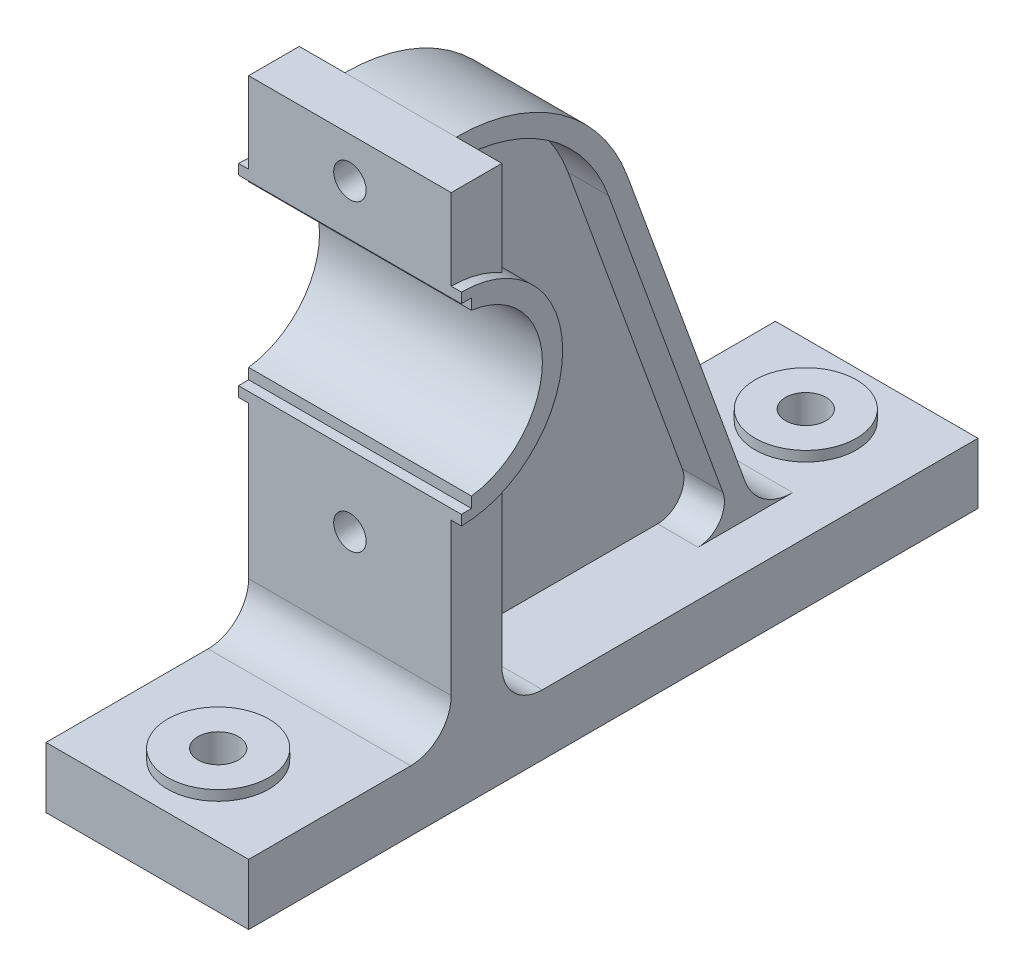
from build123d import *

# Parameters (mm, degrees)
BOSS_EXTRUDE1_DEPTH     = 50
BOSS_EXTRUDE4_DEPTH     = 55
BOSS_EXTRUDE5_DEPTH     = 27.5
CUT_EXTRUDE1_DEPTH      = 20
FILLET1_R               = 13
FILLET2_R               = 25
FILLET3_R               = 10
FILLET4_R               = 20
CUT_EXTRUDE2_DEPTH      = 461.353125329
CUT_EXTRUDE2_DEPTH_BACK = 461.353125329
CUT_EXTRUDE3_START      = -110
SKETCH14_W              = 10
SKETCH14_H              = 90
CUT_EXTRUDE3_DEPTH      = 110
SKETCH15_R              = 25
BOSS_EXTRUDE6_DEPTH     = 5
LPATTERN1_COUNT         = 2
LPATTERN1_PITCH         = 290
HOLE1_D                 = 20
HOLE2_D                 = 16
HOLE2_DEPTH             = 25
LPATTERN2_COUNT         = 2
LPATTERN2_PITCH         = 150


with BuildPart() as part:
    # Sketch2 → Boss-Extrude1 (new, symmetric)
    with BuildSketch(Plane(origin=(0, 0, 0), x_dir=(0, 0, -1), z_dir=(1, 0, 0))):
        Polygon((0, 0), (360, 0), (360, 30), (125, 30), (125, 265), (100, 265), (100, 30), (0, 30), align=None)
    extrude(amount=BOSS_EXTRUDE1_DEPTH, both=True)

    # Sketch7 → Boss-Extrude4 (add, symmetric)
    with BuildSketch(Plane(origin=(0, 0, 0), x_dir=(0, 0, -1), z_dir=(1, 0, 0))):
        with BuildLine():
            Line((100, 225), (100, 125))
            ThreePointArc((100, 125), (150, 175), (100, 225))
        make_face()
    extrude(amount=BOSS_EXTRUDE4_DEPTH, both=True)

    # Sketch11 → Boss-Extrude5 (add, symmetric)
    with BuildSketch(Plane(origin=(0, 0, 0), x_dir=(0, 0, -1), z_dir=(1, 0, 0))):
        with BuildLine():
            Line((209.572335871, 205.781812899), (273.551683491, 30))
            Line((273.551683491, 30), (125, 30))
            Line((125, 30), (125, 265))
            ThreePointArc((125, 265), (176.621879272, 248.723683986), (209.572335871, 205.781812899))
        make_face()
    extrude(amount=BOSS_EXTRUDE5_DEPTH, both=True)

    # Sketch12 → Cut-Extrude1 (cut)
    with BuildSketch(Plane(origin=(27.5, 0, 0), x_dir=(0, 0, -1), z_dir=(1, 0, 0))):
        with BuildLine():
            Line((125, 255), (125, 218.301270189))
            ThreePointArc((125, 218.301270189), (150, 175), (125, 131.698729811))
            Line((125, 131.698729811), (125, 30))
            Line((125, 30), (262.909905767, 30))
            Line((262.909905767, 30), (200.175409663, 202.361611466))
            ThreePointArc((200.175409663, 202.361611466), (170.886114908, 240.532163543), (125, 255))
        make_face()
    cut_extrude1 = extrude(amount=-CUT_EXTRUDE1_DEPTH, mode=Mode.SUBTRACT)

    # Mirror1: Cut-Extrude1 across plane
    add(cut_extrude1.mirror(Plane(origin=(0, 0, 0), x_dir=(0, 0, 1), z_dir=(1, 0, 0))), mode=Mode.SUBTRACT)

    # Fillet1
    fillet1_edges = [part.edges().sort_by_distance(p)[0] for p in [
        (17.5, 30, -262.909905767),
        (-17.5, 30, -262.909905767),
    ]]
    fillet(fillet1_edges, radius=FILLET1_R)

    # Fillet2
    fillet2_edges = [part.edges().sort_by_distance(p)[0] for p in [
        (0, 30, -273.551683491),
    ]]
    fillet(fillet2_edges, radius=FILLET2_R)

    # Fillet3
    fillet3_edges = [part.edges().sort_by_distance(p)[0] for p in [
        (17.5, 255, -125),
        (-17.5, 255, -125),
    ]]
    fillet(fillet3_edges, radius=FILLET3_R)

    # Fillet4
    fillet4_edges = [part.edges().sort_by_distance(p)[0] for p in [
        (0, 30, -100),
        (28.75, 30, -125),
        (-28.75, 30, -125),
    ]]
    fillet(fillet4_edges, radius=FILLET4_R)

    # Sketch13 → Cut-Extrude2 (cut, two sides: drawn at the far end of the back side and taken through both)
    with BuildSketch(Plane(origin=(55, 0, 0), x_dir=(0, 0, -1), z_dir=(1, 0, 0)).offset(-CUT_EXTRUDE2_DEPTH_BACK)):
        with BuildLine():
            Line((100, 215), (100, 135))
            ThreePointArc((100, 135), (140, 175), (100, 215))
        make_face()
    extrude(amount=CUT_EXTRUDE2_DEPTH + CUT_EXTRUDE2_DEPTH_BACK, mode=Mode.SUBTRACT)

    # Sketch14 → Cut-Extrude3 (cut)
    with BuildSketch(Plane(origin=(55, 0, 0), x_dir=(0, 0, -1), z_dir=(1, 0, 0)).offset(CUT_EXTRUDE3_START)):
        with Locations((100, 175)):
            Rectangle(SKETCH14_W, SKETCH14_H)
    extrude(amount=CUT_EXTRUDE3_DEPTH, mode=Mode.SUBTRACT)

    # Sketch15 → Boss-Extrude6 (add)
    with BuildSketch(Plane(origin=(0, 30, 0), x_dir=(1, 0, 0), z_dir=(0, 1, 0))):
        with Locations(Location((0, 35, 0), (0, 0, 90))):
            Circle(SKETCH15_R)
    boss_extrude6 = extrude(amount=BOSS_EXTRUDE6_DEPTH)

    # LPattern1: Boss-Extrude6 ×2
    with Locations(*[(0, 0, -i * LPATTERN1_PITCH) for i in range(1, LPATTERN1_COUNT)]):
        add(boss_extrude6)

    # Hole1 (through all)
    with Locations(Plane(origin=(0, 35, 0), x_dir=(1, 0, 0), z_dir=(0, 1, 0))):
        with Locations((0, 35), (0, 325)):
            Hole(HOLE1_D / 2)

    # Hole2
    with Locations(Plane.XY.offset(-100)):
        with Locations((0, 245)):
            hole2 = Hole(HOLE2_D / 2, depth=HOLE2_DEPTH)

    # LPattern2: Hole2 ×2
    with Locations(*[(0, -i * LPATTERN2_PITCH, 0) for i in range(1, LPATTERN2_COUNT)]):
        add(hole2, mode=Mode.SUBTRACT)


solid = part.part
